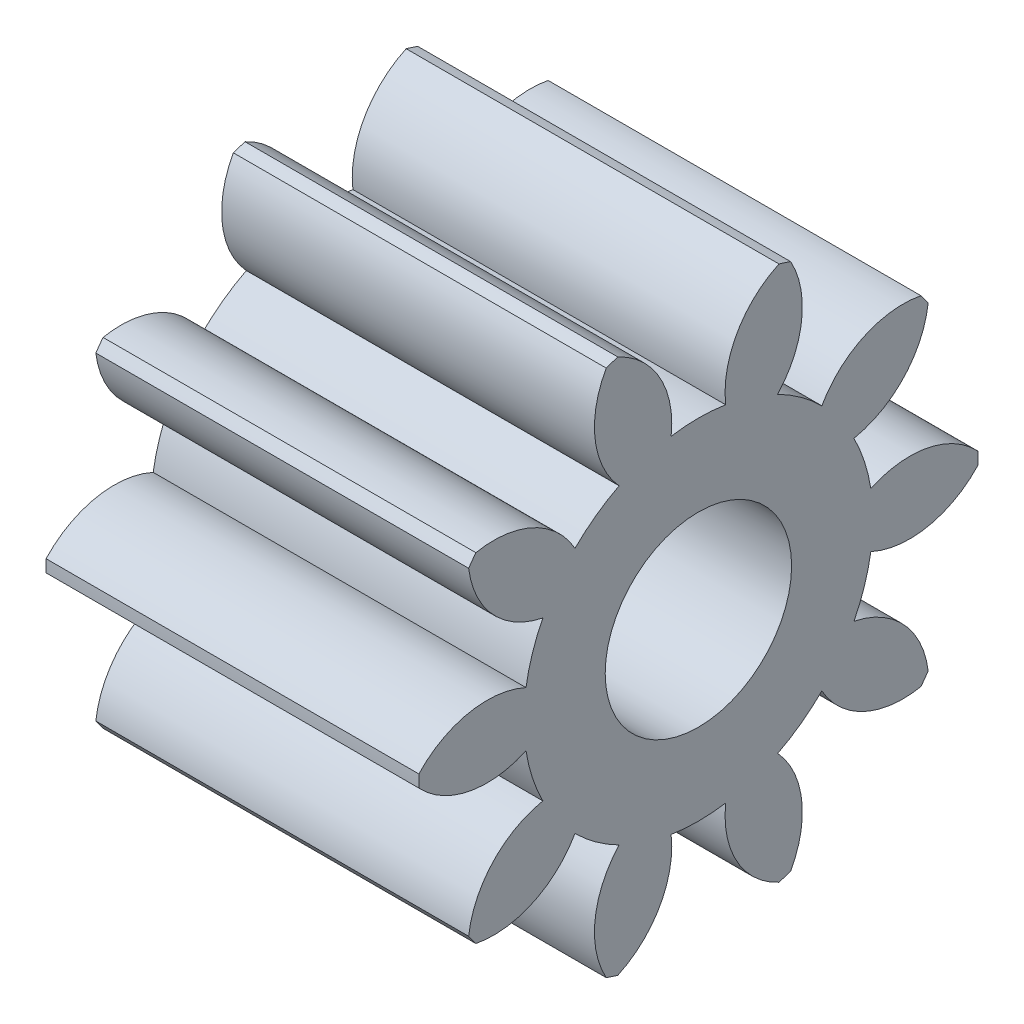
from build123d import *

# Parameters (mm, degrees)
BASPROSKE_W     = 2
BASPROSKE_H     = 1.5
TOOTHCUT_DEPTH  = 3.915475947
TEETHCUTS_COUNT = 10
TEETHCUTS_ANGLE = 324
BORSKE_R        = 0.5
BORE_DEPTH      = 50.0000508


with BuildPart() as part:
    # BasProSke → Base-Revolve (revolve)
    with BuildSketch(Plane(origin=(0, 0, 0), x_dir=(1, 0, 0), z_dir=(0, 1, 0)), mode=Mode.PRIVATE) as base_revolve_sk:
        with Locations((1, 0.75)):
            Rectangle(BASPROSKE_W, BASPROSKE_H)
    revolve(base_revolve_sk.sketch.rotate(Axis((-10, 0, 0), (1, 0, 0)), 180), axis=Axis((-10, 0, 0), (1, 0, 0)))

    # TooCutSke → ToothCut (cut, through all)
    with BuildSketch(Plane(origin=(0, 0, 0), x_dir=(0, 0, -1), z_dir=(1, 0, 0))):
        with BuildLine():
            ThreePointArc((0.146321185, 0.924998573), (0, 0.9365), (-0.146321185, 0.924998573))
            ThreePointArc((-0.146321185, 0.924998573), (-0.216454601, 1.244005636), (-0.468585949, 1.451644712))
            ThreePointArc((-0.468585949, 1.451644712), (0, 1.5254), (0.468585949, 1.451644712))
            ThreePointArc((0.468585949, 1.451644712), (0.216454601, 1.244005636), (0.146321185, 0.924998573))
        make_face()
    toothcut = extrude(amount=TOOTHCUT_DEPTH, mode=Mode.SUBTRACT)

    # TeethCuts: ToothCut ×10 about axis
    teethcuts_axis = Axis((-10, 0, 0), (1, 0, 0))
    for i in range(1, TEETHCUTS_COUNT):
        add(toothcut.rotate(teethcuts_axis, i * TEETHCUTS_ANGLE / (TEETHCUTS_COUNT - 1)), mode=Mode.SUBTRACT)

    # BorSke → Bore (cut, symmetric)
    with BuildSketch(Plane(origin=(0, 0, 0), x_dir=(0, 0, -1), z_dir=(1, 0, 0))):
        with Locations(Location((0, 0, 0), (0, 0, 180))):
            Circle(BORSKE_R)
    extrude(amount=BORE_DEPTH, both=True, mode=Mode.SUBTRACT)


solid = part.part
